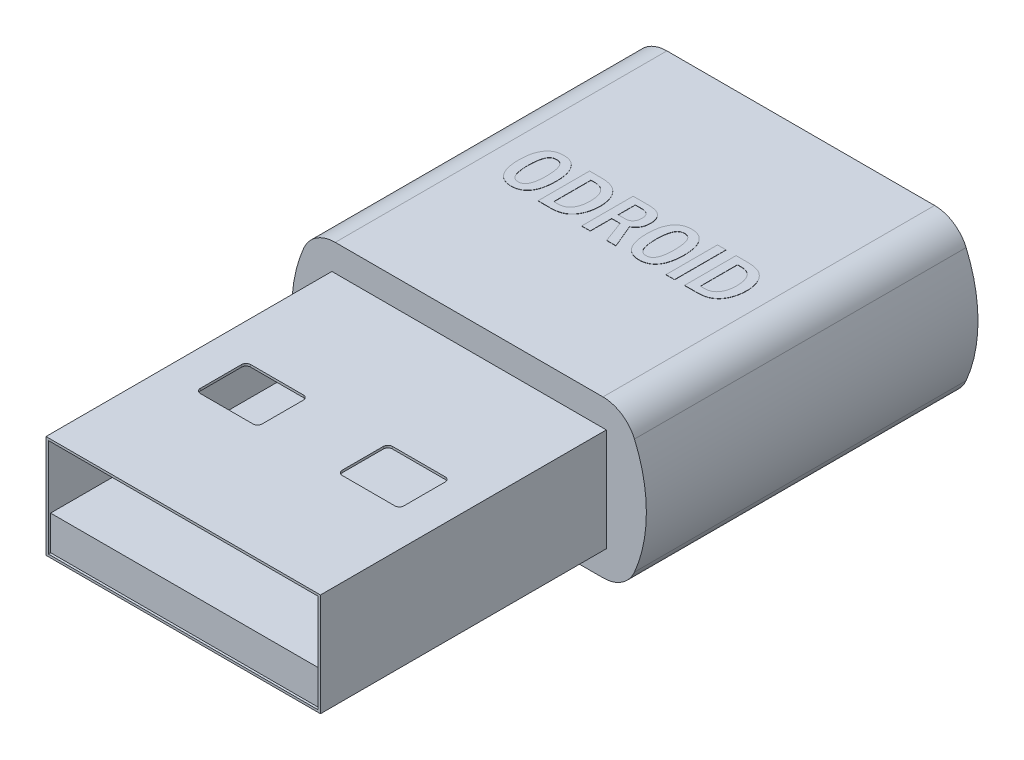
from build123d import *

# Parameters (mm, degrees)
BOSS_EXTRUDE1_DEPTH = 14.5
SKETCH2_W           = 12
SKETCH2_H           = 4.5
SKETCH2_W_2         = 11.8
SKETCH2_H_2         = 4.3
BOSS_EXTRUDE2_DEPTH = 12.5
SKETCH3_W           = 11.8
SKETCH3_H           = 1.5
BOSS_EXTRUDE3_DEPTH = 12.4
CUT_EXTRUDE1_DEPTH  = 0.5
SKETCH5_W           = 0.375
SKETCH5_H           = 2.25
BOSS_EXTRUDE4_DEPTH = 0.01


with BuildPart() as part:
    # Sketch1 → Boss-Extrude1 (new body)
    with BuildSketch(Plane.XY):
        with BuildLine():
            Line((-5.85298032, 3.425), (5.85298032, 3.425))
            ThreePointArc((5.85298032, 3.425), (6.677531535, 3.178042415), (7.230577181, 2.518487058))
            ThreePointArc((7.230577181, 2.518487058), (7.75, 0), (7.230577181, -2.518487058))
            ThreePointArc((7.230577181, -2.518487058), (6.677531535, -3.178042415), (5.85298032, -3.425))
            Line((5.85298032, -3.425), (-5.85298032, -3.425))
            ThreePointArc((-5.85298032, -3.425), (-6.677531535, -3.178042415), (-7.230577181, -2.518487058))
            ThreePointArc((-7.230577181, -2.518487058), (-7.75, 0), (-7.230577181, 2.518487058))
            ThreePointArc((-7.230577181, 2.518487058), (-6.677531535, 3.178042415), (-5.85298032, 3.425))
        make_face()
    extrude(amount=-BOSS_EXTRUDE1_DEPTH)

    # Sketch2 → Boss-Extrude2 (add)
    with BuildSketch(Plane.XY):
        Rectangle(SKETCH2_W, SKETCH2_H)
        Rectangle(SKETCH2_W_2, SKETCH2_H_2, mode=Mode.SUBTRACT)
    extrude(amount=BOSS_EXTRUDE2_DEPTH)

    # Sketch3 → Boss-Extrude3 (add)
    with BuildSketch(Plane.XY):
        with Locations((0, -1.4)):
            Rectangle(SKETCH3_W, SKETCH3_H)
    extrude(amount=BOSS_EXTRUDE3_DEPTH)

    # Sketch4 → Cut-Extrude1 (cut)
    with BuildSketch(Plane(origin=(0, 2.25, 0), x_dir=(1, 0, 0), z_dir=(0, 1, 0))):
        with BuildLine():
            Line((-4.25, -5.3), (-1.95, -5.3))
            ThreePointArc((-1.95, -5.3), (-1.808578644, -5.358578644), (-1.75, -5.5))
            Line((-1.75, -5.5), (-1.75, -7.3))
            ThreePointArc((-1.75, -7.3), (-1.808578644, -7.441421356), (-1.95, -7.5))
            Line((-1.95, -7.5), (-4.25, -7.5))
            ThreePointArc((-4.25, -7.5), (-4.391421356, -7.441421356), (-4.45, -7.3))
            Line((-4.45, -7.3), (-4.45, -5.5))
            ThreePointArc((-4.45, -5.5), (-4.391421356, -5.358578644), (-4.25, -5.3))
        make_face()
        with BuildLine():
            Line((1.95, -5.3), (4.25, -5.3))
            ThreePointArc((4.25, -5.3), (4.391421356, -5.358578644), (4.45, -5.5))
            Line((4.45, -5.5), (4.45, -7.3))
            ThreePointArc((4.45, -7.3), (4.391421356, -7.441421356), (4.25, -7.5))
            Line((4.25, -7.5), (1.95, -7.5))
            ThreePointArc((1.95, -7.5), (1.808578644, -7.441421356), (1.75, -7.3))
            Line((1.75, -7.3), (1.75, -5.5))
            ThreePointArc((1.75, -5.5), (1.808578644, -5.358578644), (1.95, -5.3))
        make_face()
    extrude(amount=-CUT_EXTRUDE1_DEPTH, mode=Mode.SUBTRACT)

    # Sketch5 → Boss-Extrude4 (add)
    # profile 1 of 6: a face of its own
    with BuildSketch(Plane(origin=(0, 3.425, 0), x_dir=(1, 0, 0), z_dir=(0, 1, 0))):
        with BuildLine():
            add(Edge.make_bspline(
                [(-3.328125, 7.125976563), (-3.328855693, 7.079741898), (-3.330272303, 6.990105786), (-3.339034599, 6.859906052), (-3.356056062, 6.738551686), (-3.377676735, 6.625551062), (-3.407490037, 6.521621606), (-3.441767205, 6.425753016), (-3.484940704, 6.339507656), (-3.532845541, 6.261215386), (-3.588045684, 6.19241636), (-3.648755949, 6.132268453), (-3.715714181, 6.081473035), (-3.788739505, 6.040250726), (-3.867405554, 6.007736949), (-3.952072789, 5.984965175), (-4.042501815, 5.970982965), (-4.104765461, 5.969507301), (-4.13671875, 5.96875)],
                knots=[0, 0, 0, 0, 1.387405284, 2.689791638, 3.912290092, 5.062586086, 6.138607472, 7.153780875, 8.112601016, 9.027336013, 9.90293063, 10.752477972, 11.585654305, 12.41675262, 13.262021801, 14.132822719, 15.041777053, 16, 16, 16, 16], degree=3))
            add(Edge.make_bspline(
                [(-4.13671875, 5.96875), (-4.168834333, 5.96950072), (-4.231259906, 5.970959953), (-4.322018905, 5.984981676), (-4.406872309, 6.007876992), (-4.486278844, 6.039618477), (-4.559709419, 6.08115043), (-4.627413633, 6.131580457), (-4.688949868, 6.191573837), (-4.744932945, 6.260208126), (-4.793981481, 6.338350382), (-4.837337913, 6.42488547), (-4.873101096, 6.520413635), (-4.902341404, 6.624672298), (-4.925002307, 6.737649187), (-4.941464086, 6.859298137), (-4.951193653, 6.989750037), (-4.952467114, 7.079572913), (-4.953125, 7.125976563)],
                knots=[0, 0, 0, 0, 0.959958664, 1.865946784, 2.738602594, 3.583781031, 4.416404134, 5.254643166, 6.101502103, 6.980354043, 7.897287051, 8.855145282, 9.870419088, 10.942929064, 12.090431879, 13.313763798, 14.612255936, 16, 16, 16, 16], degree=3))
            add(Edge.make_bspline(
                [(-4.953125, 7.125976563), (-4.952476394, 7.171894078), (-4.951216737, 7.261070421), (-4.941305838, 7.390496096), (-4.925671127, 7.511429011), (-4.902665438, 7.623668273), (-4.87363003, 7.727427312), (-4.838079606, 7.822864408), (-4.795622192, 7.909603937), (-4.74671532, 7.987839798), (-4.691422057, 8.057088915), (-4.630029227, 8.117269414), (-4.562365857, 8.168082577), (-4.488939602, 8.20983289), (-4.409314746, 8.241657841), (-4.3241067, 8.264498169), (-4.233088255, 8.279137694), (-4.170304863, 8.280535073), (-4.138183594, 8.28125)],
                knots=[0, 0, 0, 0, 1.375616577, 2.671583047, 3.886798661, 5.026811174, 6.101251535, 7.112067152, 8.073852531, 8.989830394, 9.87099314, 10.722775264, 11.55862007, 12.3993867, 13.246086354, 14.120312836, 15.038313529, 16, 16, 16, 16], degree=3))
            add(Edge.make_bspline(
                [(-4.138183594, 8.28125), (-4.10639434, 8.280491234), (-4.044457002, 8.279012873), (-3.954335465, 8.265030528), (-3.869997704, 8.242082272), (-3.790889884, 8.210492105), (-3.718487365, 8.168333175), (-3.650998003, 8.11833243), (-3.590498508, 8.057900099), (-3.534984343, 7.989370381), (-3.486105506, 7.911565717), (-3.443664385, 7.825093002), (-3.407494366, 7.729976675), (-3.378559539, 7.625945585), (-3.355579754, 7.513380594), (-3.339946062, 7.391958933), (-3.330020914, 7.26188413), (-3.328770093, 7.172219697), (-3.328125, 7.125976563)],
                knots=[0, 0, 0, 0, 0.954287532, 1.859308474, 2.730970896, 3.575224249, 4.409568651, 5.240626948, 6.091014766, 6.970537783, 7.884636552, 8.844405276, 9.859441762, 10.93652768, 12.084136384, 13.307189876, 14.611222124, 16, 16, 16, 16], degree=3))
        make_face()
        with BuildLine():
            add(Edge.make_bspline(
                [(-3.734375, 7.125), (-3.734628307, 7.156907034), (-3.735120961, 7.218962487), (-3.739726498, 7.309332646), (-3.746386868, 7.394527547), (-3.755768418, 7.474451744), (-3.769321364, 7.549133287), (-3.784622764, 7.618619744), (-3.80258629, 7.683176168), (-3.823776255, 7.742100717), (-3.848448761, 7.795207735), (-3.877276416, 7.841771712), (-3.910613547, 7.881172604), (-3.948225485, 7.913842396), (-3.99085878, 7.938256761), (-4.037457738, 7.956004896), (-4.088191207, 7.967058197), (-4.123477788, 7.968175919), (-4.141601563, 7.96875)],
                knots=[0, 0, 0, 0, 1.466338751, 2.851857527, 4.157661103, 5.393542737, 6.548369209, 7.644528668, 8.662803672, 9.625923542, 10.519359159, 11.349553645, 12.134964639, 12.883046436, 13.627190835, 14.380156138, 15.16802127, 16, 16, 16, 16], degree=3))
            add(Edge.make_bspline(
                [(-4.141601563, 7.96875), (-4.159726735, 7.968175704), (-4.195016038, 7.967057562), (-4.245581002, 7.956039745), (-4.292062456, 7.938387818), (-4.333953601, 7.912964317), (-4.372138424, 7.880927278), (-4.405367646, 7.841222867), (-4.434479633, 7.794743129), (-4.458294351, 7.741184221), (-4.479178879, 7.681986272), (-4.496942214, 7.617439855), (-4.51265132, 7.548067579), (-4.525282342, 7.473411279), (-4.534923823, 7.393561618), (-4.541487319, 7.308514811), (-4.54613726, 7.218475538), (-4.54662446, 7.156744667), (-4.546875, 7.125)],
                knots=[0, 0, 0, 0, 0.832976012, 1.621785547, 2.368664186, 3.111060873, 3.865746753, 4.652099208, 5.483288837, 6.38142501, 7.34316566, 8.369870719, 9.460036704, 10.61496114, 11.852324209, 13.159693035, 14.539392097, 16, 16, 16, 16], degree=3))
            add(Edge.make_bspline(
                [(-4.546875, 7.125), (-4.546563856, 7.093746158), (-4.545957524, 7.032841292), (-4.542122888, 6.943912976), (-4.535436171, 6.859846795), (-4.525515481, 6.780559117), (-4.513667608, 6.706015427), (-4.4984918, 6.636241564), (-4.480449704, 6.571563605), (-4.460420752, 6.511621645), (-4.436189062, 6.457706442), (-4.407694053, 6.410180102), (-4.373374587, 6.37056953), (-4.334897801, 6.337844981), (-4.291918219, 6.312037937), (-4.244180158, 6.293857192), (-4.19190077, 6.282944006), (-4.155490424, 6.281826263), (-4.13671875, 6.28125)],
                knots=[0, 0, 0, 0, 1.431345973, 2.789287046, 4.07561803, 5.292336487, 6.447925522, 7.5313253, 8.560357691, 9.522128114, 10.422800425, 11.262726267, 12.050210629, 12.81183465, 13.567342581, 14.33423742, 15.141201474, 16, 16, 16, 16], degree=3))
            add(Edge.make_bspline(
                [(-4.13671875, 6.28125), (-4.119092515, 6.281886359), (-4.084665204, 6.283129286), (-4.034956039, 6.293399676), (-3.989398225, 6.311107596), (-3.948187652, 6.336162786), (-3.910710848, 6.367563583), (-3.877830654, 6.406418605), (-3.848771127, 6.451899511), (-3.824382067, 6.504363534), (-3.802983988, 6.562758943), (-3.784627055, 6.626769143), (-3.768979167, 6.696386373), (-3.756669347, 6.771592819), (-3.746103963, 6.852160738), (-3.73980825, 6.938237775), (-3.735091423, 7.029732841), (-3.734618625, 7.09260369), (-3.734375, 7.125)],
                knots=[0, 0, 0, 0, 0.812502347, 1.586968033, 2.328646143, 3.056091242, 3.802012743, 4.573963627, 5.394473157, 6.284347561, 7.236843263, 8.260856074, 9.353643111, 10.52614691, 11.774863089, 13.100342196, 14.505854215, 16, 16, 16, 16], degree=3))
        make_face(mode=Mode.SUBTRACT)
    # profile 2 of 6: a face of its own
    with BuildSketch(Plane(origin=(0, 3.425, 0), x_dir=(1, 0, 0), z_dir=(0, 1, 0))):
        with BuildLine():
            Line((-2.984375, 8.25), (-2.470703125, 8.25))
            add(Edge.make_bspline(
                [(-2.470703125, 8.25), (-2.440416964, 8.249689153), (-2.381239153, 8.249081772), (-2.294874317, 8.242492479), (-2.213185505, 8.232458234), (-2.136236792, 8.218240208), (-2.063811757, 8.200522296), (-1.996195221, 8.177801245), (-1.932917366, 8.151751815), (-1.874458633, 8.120629268), (-1.820142308, 8.085720225), (-1.768857269, 8.047624581), (-1.721514728, 8.004925115), (-1.677437409, 7.958393769), (-1.636630035, 7.907875145), (-1.599789785, 7.853101288), (-1.56572854, 7.79468169), (-1.535804225, 7.732309316), (-1.509220746, 7.667146424), (-1.485593017, 7.60025774), (-1.466113238, 7.531551747), (-1.450021995, 7.461142346), (-1.437168799, 7.38881786), (-1.428656323, 7.31461265), (-1.423068526, 7.23885466), (-1.422275087, 7.187835504), (-1.421875, 7.162109375)],
                knots=[0, 0, 0, 0, 1.263284396, 2.468401565, 3.611309036, 4.695417418, 5.731308201, 6.719054966, 7.668651022, 8.582946742, 9.477667803, 10.360404409, 11.245175754, 12.133769136, 13.031987625, 13.951061707, 14.885114242, 15.850863219, 16.83442326, 17.820137358, 18.80881728, 19.811965047, 20.83231642, 21.871651036, 22.926791753, 24, 24, 24, 24], degree=3))
            add(Edge.make_bspline(
                [(-1.421875, 7.162109375), (-1.422115483, 7.135083683), (-1.422591062, 7.081637633), (-1.427611303, 7.002454036), (-1.435842665, 6.925564458), (-1.447289868, 6.85083146), (-1.460900578, 6.778286285), (-1.479416491, 6.708214711), (-1.500363084, 6.640259237), (-1.524041232, 6.57440381), (-1.55131452, 6.511387822), (-1.582224438, 6.451560763), (-1.616470658, 6.394792185), (-1.653985435, 6.340982432), (-1.69525917, 6.290518201), (-1.739794135, 6.243042883), (-1.787658562, 6.19854434), (-1.839127774, 6.157206864), (-1.895099855, 6.119577363), (-1.956834358, 6.087360273), (-2.02427777, 6.060798965), (-2.09676809, 6.037960703), (-2.175329616, 6.021413071), (-2.259244709, 6.008540058), (-2.348995174, 6.00134031), (-2.410632343, 6.000455686), (-2.442382813, 6)],
                knots=[0, 0, 0, 0, 1.103877963, 2.183030719, 3.239601398, 4.261720471, 5.270978357, 6.253064388, 7.220456393, 8.175338097, 9.110361049, 10.023280161, 10.924085786, 11.816831728, 12.700519582, 13.584832525, 14.474006079, 15.368038541, 16.27899441, 17.224712014, 18.206257744, 19.236711643, 20.325671651, 21.482253911, 22.703061461, 24, 24, 24, 24], degree=3))
            Line((-2.442382813, 6), (-2.984375, 6))
            Line((-2.984375, 6), (-2.984375, 8.25))
        make_face()
        with BuildLine():
            Line((-2.609375, 7.9375), (-2.609375, 6.3125))
            Line((-2.609375, 6.3125), (-2.452636719, 6.3125))
            add(Edge.make_bspline(
                [(-2.452636719, 6.3125), (-2.42623951, 6.313133287), (-2.375023848, 6.314361987), (-2.30092701, 6.324474339), (-2.232607151, 6.342317752), (-2.169440455, 6.365880431), (-2.112321487, 6.397465155), (-2.060956578, 6.43599244), (-2.01517123, 6.481368052), (-1.975091375, 6.53344293), (-1.940857426, 6.591420204), (-1.910204964, 6.653631135), (-1.885055662, 6.720966088), (-1.863980824, 6.792734744), (-1.848141628, 6.869199996), (-1.836317896, 6.950049567), (-1.829594729, 7.03553035), (-1.828622577, 7.094064103), (-1.828125, 7.124023438)],
                knots=[0, 0, 0, 0, 1.086842209, 2.108682856, 3.071090717, 3.989744833, 4.877738219, 5.749082486, 6.625900576, 7.524155469, 8.447200417, 9.39445797, 10.376641818, 11.403219733, 12.471971649, 13.589546538, 14.766257471, 16, 16, 16, 16], degree=3))
            add(Edge.make_bspline(
                [(-1.828125, 7.124023438), (-1.828556207, 7.156916054), (-1.829389886, 7.220509483), (-1.836845512, 7.312795698), (-1.848795985, 7.398788756), (-1.865786136, 7.478632952), (-1.887510641, 7.552085994), (-1.914534195, 7.619110593), (-1.946191897, 7.679942418), (-1.982752286, 7.734605138), (-2.024868278, 7.782379845), (-2.071222714, 7.82439937), (-2.12322168, 7.858950617), (-2.179231697, 7.888473978), (-2.240913263, 7.909959647), (-2.307054003, 7.926355411), (-2.378334029, 7.935394212), (-2.42738534, 7.936784359), (-2.452636719, 7.9375)],
                knots=[0, 0, 0, 0, 1.348651977, 2.607436369, 3.79393143, 4.906664636, 5.951914283, 6.931058685, 7.865505604, 8.7596329, 9.620455916, 10.471284759, 11.317282889, 12.174033835, 13.060756637, 13.988337191, 14.964405704, 16, 16, 16, 16], degree=3))
            Line((-2.452636719, 7.9375), (-2.609375, 7.9375))
        make_face(mode=Mode.SUBTRACT)
    # profile 3 of 6: a face of its own
    with BuildSketch(Plane(origin=(0, 3.425, 0), x_dir=(1, 0, 0), z_dir=(0, 1, 0))):
        with BuildLine():
            Line((-1.078125, 8.25), (-0.395019531, 8.25))
            add(Edge.make_bspline(
                [(-0.395019531, 8.25), (-0.365055743, 8.249594026), (-0.307133863, 8.248809254), (-0.223376935, 8.241039557), (-0.145773452, 8.22765624), (-0.07383687, 8.210407438), (-0.008513911, 8.185711712), (0.051694272, 8.15804331), (0.10513552, 8.123517897), (0.152535796, 8.084015131), (0.194219977, 8.039953019), (0.230263521, 7.991062871), (0.260334282, 7.937625702), (0.285801524, 7.879895373), (0.304347729, 7.817291136), (0.318093945, 7.750326143), (0.326438819, 7.678919982), (0.327552946, 7.62974258), (0.328125, 7.604492188)],
                knots=[0, 0, 0, 0, 1.295332569, 2.503959033, 3.631962887, 4.698704625, 5.696159239, 6.646787697, 7.558404022, 8.437807291, 9.308978304, 10.17458905, 11.057056108, 11.955236805, 12.896888598, 13.874028369, 14.908408836, 16, 16, 16, 16], degree=3))
            add(Edge.make_bspline(
                [(0.328125, 7.604492188), (0.327125118, 7.571062113), (0.325186813, 7.506256835), (0.309377841, 7.412886657), (0.283536958, 7.326945937), (0.247330686, 7.248387825), (0.199939805, 7.177582581), (0.141362423, 7.115383286), (0.073407022, 7.059492971), (0.021657145, 7.03017332), (-0.004882813, 7.015136719)],
                knots=[0, 0, 0, 0, 1.120551321, 2.172224874, 3.165041725, 4.122292126, 5.062395793, 6.008627477, 6.978723301, 8, 8, 8, 8], degree=3))
            Line((-0.004882813, 7.015136719), (0.421875, 6))
            Line((0.421875, 6), (0.015136719, 6))
            Line((0.015136719, 6), (-0.334472656, 6.9375))
            Line((-0.334472656, 6.9375), (-0.703125, 6.9375))
            Line((-0.703125, 6.9375), (-0.703125, 6))
            Line((-0.703125, 6), (-1.078125, 6))
            Line((-1.078125, 6), (-1.078125, 8.25))
        make_face()
        with BuildLine():
            Line((-0.703125, 7.96875), (-0.703125, 7.21875))
            Line((-0.703125, 7.21875), (-0.41796875, 7.21875))
            add(Edge.make_bspline(
                [(-0.41796875, 7.21875), (-0.402484781, 7.218909159), (-0.372553347, 7.219216822), (-0.329334029, 7.225035884), (-0.289176287, 7.232937309), (-0.25218985, 7.244799522), (-0.218302003, 7.259795873), (-0.187706823, 7.278636335), (-0.160077266, 7.300574556), (-0.128258892, 7.334973149), (-0.094626156, 7.384085353), (-0.067103767, 7.451907567), (-0.0492892, 7.527244541), (-0.047701499, 7.580294359), (-0.046875, 7.607910156)],
                knots=[0, 0, 0, 0, 0.909092718, 1.757330279, 2.558307297, 3.311487683, 4.034993559, 4.730520344, 5.417644261, 6.101030153, 7.477871726, 8.888289726, 10.380157268, 12, 12, 12, 12], degree=3))
            add(Edge.make_bspline(
                [(-0.046875, 7.607910156), (-0.047124815, 7.622410635), (-0.047611626, 7.650667477), (-0.052277979, 7.691582721), (-0.058655248, 7.729965501), (-0.069164657, 7.765381004), (-0.082145416, 7.797977248), (-0.098012638, 7.827787187), (-0.116505567, 7.854829561), (-0.138363395, 7.878893824), (-0.162630638, 7.900640027), (-0.190551742, 7.918632555), (-0.220863859, 7.934437425), (-0.2541874, 7.946955099), (-0.290287623, 7.956909049), (-0.329252938, 7.963330167), (-0.370981072, 7.968030202), (-0.399724986, 7.968505069), (-0.414550781, 7.96875)],
                knots=[0, 0, 0, 0, 1.177094781, 2.293784941, 3.341286462, 4.332657219, 5.287489027, 6.186331846, 7.069981309, 7.940482865, 8.82086376, 9.708065201, 10.630318304, 11.592623377, 12.593116832, 13.666649251, 14.796483342, 16, 16, 16, 16], degree=3))
            Line((-0.414550781, 7.96875), (-0.703125, 7.96875))
        make_face(mode=Mode.SUBTRACT)
    # profile 4 of 6: a face of its own
    with BuildSketch(Plane(origin=(0, 3.425, 0), x_dir=(1, 0, 0), z_dir=(0, 1, 0))):
        with BuildLine():
            add(Edge.make_bspline(
                [(2.265625, 7.125976563), (2.264894307, 7.079741898), (2.263477697, 6.990105786), (2.254715401, 6.859906052), (2.237693938, 6.738551686), (2.216073265, 6.625551062), (2.186259963, 6.521621606), (2.151982795, 6.425753016), (2.108809296, 6.339507656), (2.060904459, 6.261215386), (2.005704316, 6.19241636), (1.944994051, 6.132268453), (1.878035819, 6.081473035), (1.805010495, 6.040250726), (1.726344446, 6.007736949), (1.641677211, 5.984965175), (1.551248185, 5.970982965), (1.488984539, 5.969507301), (1.45703125, 5.96875)],
                knots=[0, 0, 0, 0, 1.387405284, 2.689791638, 3.912290092, 5.062586086, 6.138607472, 7.153780875, 8.112601016, 9.027336013, 9.90293063, 10.752477972, 11.585654305, 12.41675262, 13.262021801, 14.132822719, 15.041777053, 16, 16, 16, 16], degree=3))
            add(Edge.make_bspline(
                [(1.45703125, 5.96875), (1.424915667, 5.96950072), (1.362490094, 5.970959953), (1.271731095, 5.984981676), (1.186877691, 6.007876992), (1.107471156, 6.039618477), (1.034040581, 6.08115043), (0.966336367, 6.131580457), (0.904800132, 6.191573837), (0.848817055, 6.260208126), (0.799768519, 6.338350382), (0.756412087, 6.42488547), (0.720648904, 6.520413635), (0.691408596, 6.624672298), (0.668747693, 6.737649187), (0.652285914, 6.859298137), (0.642556347, 6.989750037), (0.641282886, 7.079572913), (0.640625, 7.125976563)],
                knots=[0, 0, 0, 0, 0.959958664, 1.865946784, 2.738602594, 3.583781031, 4.416404134, 5.254643166, 6.101502103, 6.980354043, 7.897287051, 8.855145282, 9.870419088, 10.942929064, 12.090431879, 13.313763798, 14.612255936, 16, 16, 16, 16], degree=3))
            add(Edge.make_bspline(
                [(0.640625, 7.125976563), (0.641273606, 7.171894078), (0.642533263, 7.261070421), (0.652444162, 7.390496096), (0.668078873, 7.511429011), (0.691084562, 7.623668273), (0.72011997, 7.727427312), (0.755670394, 7.822864408), (0.798127808, 7.909603937), (0.84703468, 7.987839798), (0.902327943, 8.057088915), (0.963720773, 8.117269414), (1.031384143, 8.168082577), (1.104810398, 8.20983289), (1.184435254, 8.241657841), (1.2696433, 8.264498169), (1.360661745, 8.279137694), (1.423445137, 8.280535073), (1.455566406, 8.28125)],
                knots=[0, 0, 0, 0, 1.375616577, 2.671583047, 3.886798661, 5.026811174, 6.101251535, 7.112067152, 8.073852531, 8.989830394, 9.87099314, 10.722775264, 11.55862007, 12.3993867, 13.246086354, 14.120312836, 15.038313529, 16, 16, 16, 16], degree=3))
            add(Edge.make_bspline(
                [(1.455566406, 8.28125), (1.48735566, 8.280491234), (1.549292998, 8.279012873), (1.639414535, 8.265030528), (1.723752296, 8.242082272), (1.802860116, 8.210492105), (1.875262635, 8.168333175), (1.942751997, 8.11833243), (2.003251492, 8.057900099), (2.058765657, 7.989370381), (2.107644494, 7.911565717), (2.150085615, 7.825093002), (2.186255634, 7.729976675), (2.215190461, 7.625945585), (2.238170246, 7.513380594), (2.253803938, 7.391958933), (2.263729086, 7.26188413), (2.264979907, 7.172219697), (2.265625, 7.125976563)],
                knots=[0, 0, 0, 0, 0.954287532, 1.859308474, 2.730970896, 3.575224249, 4.409568651, 5.240626948, 6.091014766, 6.970537783, 7.884636552, 8.844405276, 9.859441762, 10.93652768, 12.084136384, 13.307189876, 14.611222124, 16, 16, 16, 16], degree=3))
        make_face()
        with BuildLine():
            add(Edge.make_bspline(
                [(1.859375, 7.125), (1.859121693, 7.156907034), (1.858629039, 7.218962487), (1.854023502, 7.309332646), (1.847363132, 7.394527547), (1.837981582, 7.474451744), (1.824428636, 7.549133287), (1.809127236, 7.618619744), (1.79116371, 7.683176168), (1.769973745, 7.742100717), (1.745301239, 7.795207735), (1.716473584, 7.841771712), (1.683136453, 7.881172604), (1.645524515, 7.913842396), (1.60289122, 7.938256761), (1.556292262, 7.956004896), (1.505558793, 7.967058197), (1.470272212, 7.968175919), (1.452148437, 7.96875)],
                knots=[0, 0, 0, 0, 1.466338751, 2.851857527, 4.157661103, 5.393542737, 6.548369209, 7.644528668, 8.662803672, 9.625923542, 10.519359159, 11.349553645, 12.134964639, 12.883046436, 13.627190835, 14.380156138, 15.16802127, 16, 16, 16, 16], degree=3))
            add(Edge.make_bspline(
                [(1.452148437, 7.96875), (1.434023265, 7.968175704), (1.398733962, 7.967057562), (1.348168998, 7.956039745), (1.301687544, 7.938387818), (1.259796399, 7.912964317), (1.221611576, 7.880927278), (1.188382354, 7.841222867), (1.159270367, 7.794743129), (1.135455649, 7.741184221), (1.114571121, 7.681986272), (1.096807786, 7.617439855), (1.08109868, 7.548067579), (1.068467658, 7.473411279), (1.058826177, 7.393561618), (1.052262681, 7.308514811), (1.04761274, 7.218475538), (1.04712554, 7.156744667), (1.046875, 7.125)],
                knots=[0, 0, 0, 0, 0.832976012, 1.621785547, 2.368664186, 3.111060873, 3.865746753, 4.652099208, 5.483288837, 6.38142501, 7.34316566, 8.369870719, 9.460036704, 10.61496114, 11.852324209, 13.159693035, 14.539392097, 16, 16, 16, 16], degree=3))
            add(Edge.make_bspline(
                [(1.046875, 7.125), (1.047186144, 7.093746158), (1.047792476, 7.032841292), (1.051627112, 6.943912976), (1.058313829, 6.859846795), (1.068234519, 6.780559117), (1.080082392, 6.706015427), (1.0952582, 6.636241564), (1.113300296, 6.571563605), (1.133329248, 6.511621645), (1.157560938, 6.457706442), (1.186055947, 6.410180102), (1.220375413, 6.37056953), (1.258852199, 6.337844981), (1.301831781, 6.312037937), (1.349569842, 6.293857192), (1.40184923, 6.282944006), (1.438259576, 6.281826263), (1.45703125, 6.28125)],
                knots=[0, 0, 0, 0, 1.431345973, 2.789287046, 4.07561803, 5.292336487, 6.447925522, 7.5313253, 8.560357691, 9.522128114, 10.422800425, 11.262726267, 12.050210629, 12.81183465, 13.567342581, 14.33423742, 15.141201474, 16, 16, 16, 16], degree=3))
            add(Edge.make_bspline(
                [(1.45703125, 6.28125), (1.474657485, 6.281886359), (1.509084796, 6.283129286), (1.558793961, 6.293399676), (1.604351775, 6.311107596), (1.645562348, 6.336162786), (1.683039152, 6.367563583), (1.715919346, 6.406418605), (1.744978873, 6.451899511), (1.769367933, 6.504363534), (1.790766012, 6.562758943), (1.809122945, 6.626769143), (1.824770833, 6.696386373), (1.837080653, 6.771592819), (1.847646037, 6.852160738), (1.85394175, 6.938237775), (1.858658577, 7.029732841), (1.859131375, 7.09260369), (1.859375, 7.125)],
                knots=[0, 0, 0, 0, 0.812502347, 1.586968033, 2.328646143, 3.056091242, 3.802012743, 4.573963627, 5.394473157, 6.284347561, 7.236843263, 8.260856074, 9.353643111, 10.52614691, 11.774863089, 13.100342196, 14.505854215, 16, 16, 16, 16], degree=3))
        make_face(mode=Mode.SUBTRACT)
    # profile 5 of 6: a face of its own
    with BuildSketch(Plane(origin=(0, 3.425, 0), x_dir=(1, 0, 0), z_dir=(0, 1, 0))):
        with Locations((2.796875, 7.125)):
            Rectangle(SKETCH5_W, SKETCH5_H)
    # profile 6 of 6: a face of its own
    with BuildSketch(Plane(origin=(0, 3.425, 0), x_dir=(1, 0, 0), z_dir=(0, 1, 0))):
        with BuildLine():
            Line((3.421875, 8.25), (3.935546875, 8.25))
            add(Edge.make_bspline(
                [(3.935546875, 8.25), (3.965833036, 8.249689153), (4.025010847, 8.249081772), (4.111375683, 8.242492479), (4.193064495, 8.232458234), (4.270013208, 8.218240208), (4.342438243, 8.200522296), (4.410054779, 8.177801245), (4.473332634, 8.151751815), (4.531791367, 8.120629268), (4.586107692, 8.085720225), (4.637392731, 8.047624581), (4.684735272, 8.004925115), (4.728812591, 7.958393769), (4.769619965, 7.907875145), (4.806460215, 7.853101288), (4.84052146, 7.79468169), (4.870445775, 7.732309316), (4.897029254, 7.667146424), (4.920656983, 7.60025774), (4.940136762, 7.531551747), (4.956228005, 7.461142346), (4.969081201, 7.38881786), (4.977593677, 7.31461265), (4.983181474, 7.23885466), (4.983974913, 7.187835504), (4.984375, 7.162109375)],
                knots=[0, 0, 0, 0, 1.263284396, 2.468401565, 3.611309036, 4.695417418, 5.731308201, 6.719054966, 7.668651022, 8.582946742, 9.477667803, 10.360404409, 11.245175754, 12.133769136, 13.031987625, 13.951061707, 14.885114242, 15.850863219, 16.83442326, 17.820137358, 18.80881728, 19.811965047, 20.83231642, 21.871651036, 22.926791753, 24, 24, 24, 24], degree=3))
            add(Edge.make_bspline(
                [(4.984375, 7.162109375), (4.984134517, 7.135083683), (4.983658938, 7.081637633), (4.978638697, 7.002454036), (4.970407335, 6.925564458), (4.958960132, 6.85083146), (4.945349422, 6.778286285), (4.926833509, 6.708214711), (4.905886916, 6.640259237), (4.882208768, 6.57440381), (4.85493548, 6.511387822), (4.824025562, 6.451560763), (4.789779342, 6.394792185), (4.752264565, 6.340982432), (4.71099083, 6.290518201), (4.666455865, 6.243042883), (4.618591438, 6.19854434), (4.567122226, 6.157206864), (4.511150145, 6.119577363), (4.449415642, 6.087360273), (4.38197223, 6.060798965), (4.30948191, 6.037960703), (4.230920384, 6.021413071), (4.147005291, 6.008540058), (4.057254826, 6.00134031), (3.995617657, 6.000455686), (3.963867187, 6)],
                knots=[0, 0, 0, 0, 1.103877963, 2.183030719, 3.239601398, 4.261720471, 5.270978357, 6.253064388, 7.220456393, 8.175338097, 9.110361049, 10.023280161, 10.924085786, 11.816831728, 12.700519582, 13.584832525, 14.474006079, 15.368038541, 16.27899441, 17.224712014, 18.206257744, 19.236711643, 20.325671651, 21.482253911, 22.703061461, 24, 24, 24, 24], degree=3))
            Line((3.963867187, 6), (3.421875, 6))
            Line((3.421875, 6), (3.421875, 8.25))
        make_face()
        with BuildLine():
            Line((3.796875, 7.9375), (3.796875, 6.3125))
            Line((3.796875, 6.3125), (3.953613281, 6.3125))
            add(Edge.make_bspline(
                [(3.953613281, 6.3125), (3.98001049, 6.313133287), (4.031226152, 6.314361987), (4.10532299, 6.324474339), (4.173642849, 6.342317752), (4.236809545, 6.365880431), (4.293928513, 6.397465155), (4.345293422, 6.43599244), (4.39107877, 6.481368052), (4.431158625, 6.53344293), (4.465392574, 6.591420204), (4.496045036, 6.653631135), (4.521194338, 6.720966088), (4.542269176, 6.792734744), (4.558108372, 6.869199996), (4.569932104, 6.950049567), (4.576655271, 7.03553035), (4.577627423, 7.094064103), (4.578125, 7.124023438)],
                knots=[0, 0, 0, 0, 1.086842209, 2.108682856, 3.071090717, 3.989744833, 4.877738219, 5.749082486, 6.625900576, 7.524155469, 8.447200417, 9.39445797, 10.376641818, 11.403219733, 12.471971649, 13.589546538, 14.766257471, 16, 16, 16, 16], degree=3))
            add(Edge.make_bspline(
                [(4.578125, 7.124023438), (4.577693793, 7.156916054), (4.576860114, 7.220509483), (4.569404488, 7.312795698), (4.557454015, 7.398788756), (4.540463864, 7.478632952), (4.518739359, 7.552085994), (4.491715805, 7.619110593), (4.460058103, 7.679942418), (4.423497714, 7.734605138), (4.381381722, 7.782379845), (4.335027286, 7.82439937), (4.28302832, 7.858950617), (4.227018303, 7.888473978), (4.165336737, 7.909959647), (4.099195997, 7.926355411), (4.027915971, 7.935394212), (3.97886466, 7.936784359), (3.953613281, 7.9375)],
                knots=[0, 0, 0, 0, 1.348651977, 2.607436369, 3.79393143, 4.906664636, 5.951914283, 6.931058685, 7.865505604, 8.7596329, 9.620455916, 10.471284759, 11.317282889, 12.174033835, 13.060756637, 13.988337191, 14.964405704, 16, 16, 16, 16], degree=3))
            Line((3.953613281, 7.9375), (3.796875, 7.9375))
        make_face(mode=Mode.SUBTRACT)
    extrude(amount=BOSS_EXTRUDE4_DEPTH)


solid = part.part
